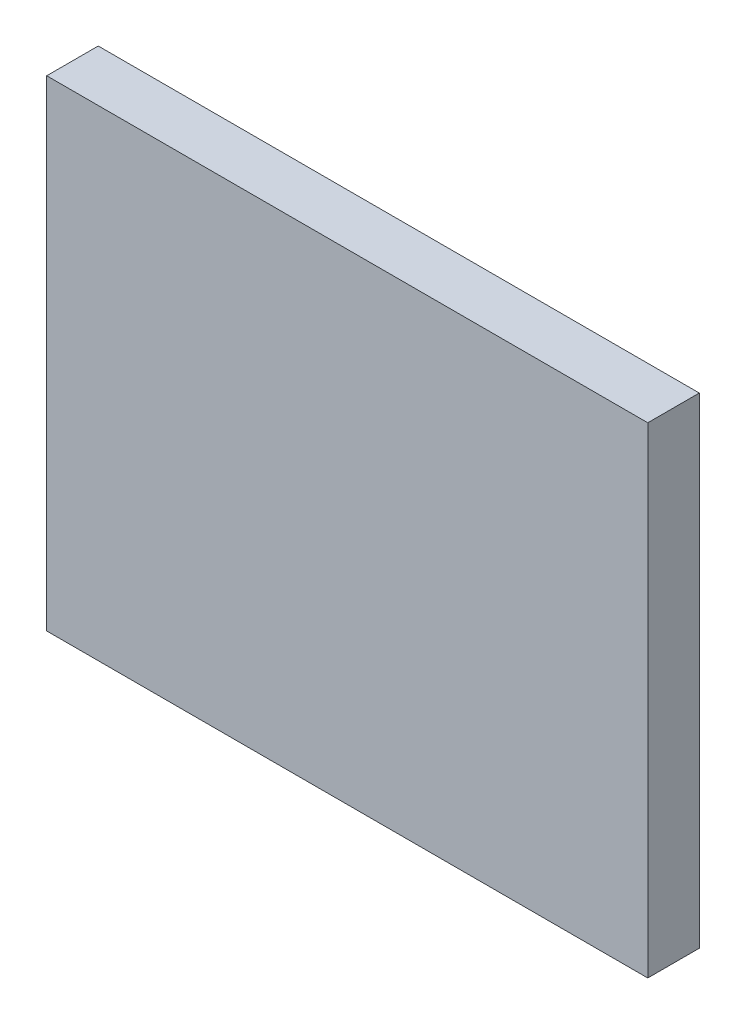
from build123d import *

# Parameters (mm, degrees)
ESQUISSE1_W        = 350
ESQUISSE1_H        = 280
BOSS_EXTRU_1_DEPTH = 30


with BuildPart() as part:
    # Esquisse1 → Boss.-Extru.1 (new body)
    with BuildSketch(Plane.XY):
        with Locations((175, 140)):
            Rectangle(ESQUISSE1_W, ESQUISSE1_H)
    extrude(amount=BOSS_EXTRU_1_DEPTH)


solid = part.part
